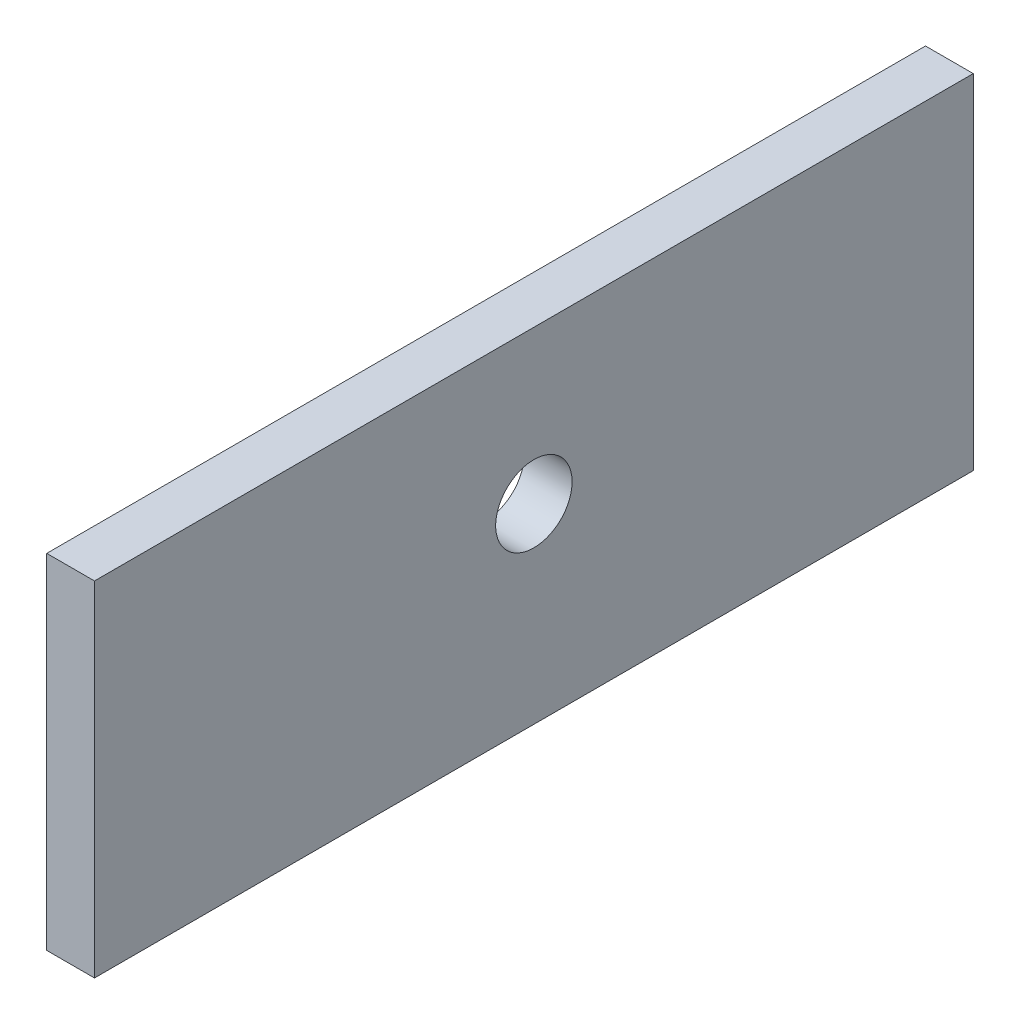
from build123d import *

# Parameters (mm, degrees)
SKETCH_1_W          = 46
SKETCH_1_H          = 18
EXTRUDE_1_DEPTH     = 2.5
SKETCH_2_R          = 2
CUT_EXTRUDE_2_DEPTH = 50.459579456


with BuildPart() as part:
    # 草图1 → 凸台-拉伸1 (new body)
    with BuildSketch(Plane(origin=(0, 0, 0), x_dir=(0, 0, -1), z_dir=(1, 0, 0))):
        with Locations((23, 9)):
            Rectangle(SKETCH_1_W, SKETCH_1_H)
    extrude(amount=EXTRUDE_1_DEPTH)

    # 草图2 → 切除-拉伸2 (cut, through all)
    with BuildSketch(Plane(origin=(2.5, 0, 0), x_dir=(0, 0, -1), z_dir=(1, 0, 0))):
        with Locations((23, 10)):
            Circle(SKETCH_2_R)
    extrude(amount=-CUT_EXTRUDE_2_DEPTH, mode=Mode.SUBTRACT)


solid = part.part
